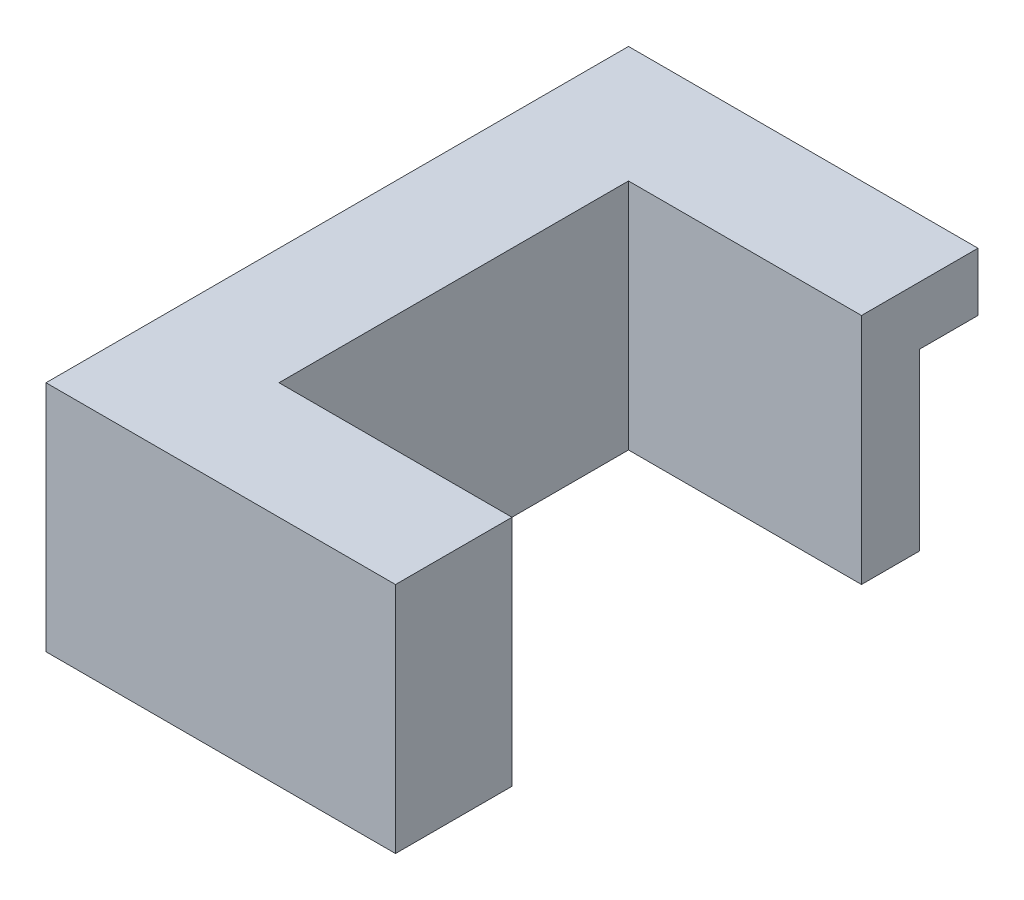
from build123d import *

# Parameters (mm, degrees)
BOSS_EXTRUDE1_DEPTH = 20
SKETCH2_W           = 5
SKETCH2_H           = 15
CUT_EXTRUDE1_DEPTH  = 18


with BuildPart() as part:
    # Sketch1 → Boss-Extrude1 (new body)
    with BuildSketch(Plane(origin=(0, 0, 0), x_dir=(1, 0, 0), z_dir=(0, 1, 0))):
        Polygon((0, 0), (0, -50), (30, -50), (30, -40), (10, -40), (10, -10), (30, -10), (30, 0), align=None)
    extrude(amount=BOSS_EXTRUDE1_DEPTH)

    # Sketch2 → Cut-Extrude1 (cut)
    with BuildSketch(Plane(origin=(30, 0, 0), x_dir=(0, 0, -1), z_dir=(1, 0, 0))):
        with Locations((-2.5, 7.5)):
            Rectangle(SKETCH2_W, SKETCH2_H)
    extrude(amount=-CUT_EXTRUDE1_DEPTH, mode=Mode.SUBTRACT)


solid = part.part
